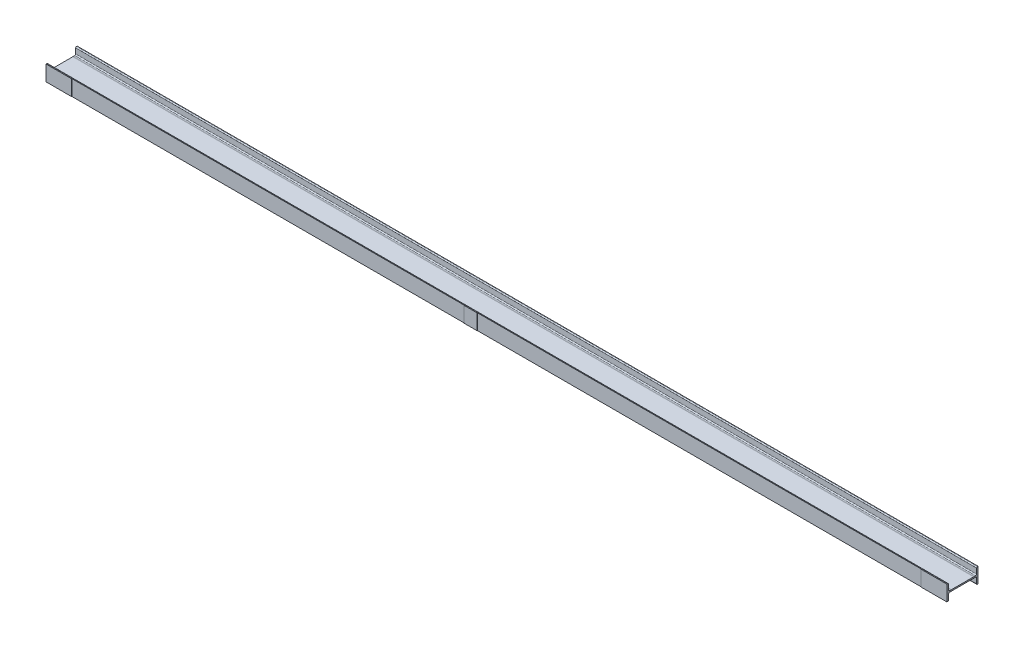
from build123d import *

# Parameters (mm, degrees)
VIGA_SB_120_X_12_2_DEPTH   = 3500
CORTAR_EXTRUIR1_DEPTH      = 3501.642798116
CORTAR_EXTRUIR1_DEPTH_BACK = 3501.642798116
CROQUIS4_W                 = 50.341677604
CROQUIS4_H                 = 60
SALIENTE_EXTRUIR1_DEPTH    = 1
CROQUIS6_W                 = 100
CROQUIS6_H                 = 60
SALIENTE_EXTRUIR2_DEPTH    = 1
SALIENTE_EXTRUIR2_2_DEPTH  = 1


with BuildPart() as part:
    # Sketch12 → Viga sb 120 X 12(2) (new body)
    with BuildSketch(Plane.YZ):
        with BuildLine():
            Line((-30, -60), (-30, -58.080070835))
            ThreePointArc((-30, -58.080070835), (-29.052095223, -55.494589303), (-26.657642624, -54.134502919))
            Line((-26.657642624, -54.134502919), (-9.184714752, -51.222135832))
            ThreePointArc((-9.184714752, -51.222135832), (-4.395809555, -48.501963064), (-2.5, -43.331))
            Line((-2.5, -43.331), (-2.5, 43.331))
            ThreePointArc((-2.5, 43.331), (-4.395809555, 48.501963064), (-9.184714752, 51.222135832))
            Line((-9.184714752, 51.222135832), (-26.657642624, 54.134502919))
            ThreePointArc((-26.657642624, 54.134502919), (-29.052095223, 55.494589303), (-30, 58.080070835))
            Line((-30, 58.080070835), (-30, 60))
            Line((-30, 60), (30, 60))
            Line((30, 60), (30, 58.080070835))
            ThreePointArc((30, 58.080070835), (29.052095223, 55.494589303), (26.657642624, 54.134502919))
            Line((26.657642624, 54.134502919), (9.184714752, 51.222135832))
            ThreePointArc((9.184714752, 51.222135832), (4.395809555, 48.501963064), (2.5, 43.331))
            Line((2.5, 43.331), (2.5, -43.331))
            ThreePointArc((2.5, -43.331), (4.395809555, -48.501963064), (9.184714752, -51.222135832))
            Line((9.184714752, -51.222135832), (26.657642624, -54.134502919))
            ThreePointArc((26.657642624, -54.134502919), (29.052095223, -55.494589303), (30, -58.080070835))
            Line((30, -58.080070835), (30, -60))
            Line((30, -60), (-30, -60))
        make_face()
    extrude(amount=VIGA_SB_120_X_12_2_DEPTH)

    # Croquis3 → Cortar-Extruir1 (cut, two sides: drawn at the far end of the back side and taken through both)
    with BuildSketch(Plane.ZY.offset(-CORTAR_EXTRUIR1_DEPTH_BACK)):
        with BuildLine():
            Line((54.134502919, 26.657642624), (44.900203823, 26.657642624))
            Line((44.900203823, 26.657642624), (44.900203823, 2.655409548))
            Line((44.900203823, 2.655409548), (50.134502919, 2.655409548))
            ThreePointArc((50.134502919, 2.655409548), (52.962930044, 3.826982423), (54.134502919, 6.655409548))
            Line((54.134502919, 6.655409548), (54.134502919, 26.657642624))
        make_face()
        with BuildLine():
            Line((54.134502919, -26.657642624), (43.331, -26.657642624))
            Line((43.331, -26.657642624), (43.331, -2.5))
            Line((43.331, -2.5), (50.134502919, -2.5))
            ThreePointArc((50.134502919, -2.5), (52.962930044, -3.671572875), (54.134502919, -6.5))
            Line((54.134502919, -6.5), (54.134502919, -26.657642624))
        make_face()
        with BuildLine():
            Line((-43.331, -26.657642624), (-43.331, -2.5))
            Line((-43.331, -2.5), (-50.134502919, -2.5))
            ThreePointArc((-50.134502919, -2.5), (-52.962930044, -3.671572875), (-54.134502919, -6.5))
            Line((-54.134502919, -6.5), (-54.134502919, -26.657642624))
            Line((-54.134502919, -26.657642624), (-43.331, -26.657642624))
        make_face()
        with BuildLine():
            Line((-44.900203823, 26.657642624), (-44.900203823, 2.655409548))
            Line((-44.900203823, 2.655409548), (-50.134502919, 2.655409548))
            ThreePointArc((-50.134502919, 2.655409548), (-52.962930044, 3.826982423), (-54.134502919, 6.655409548))
            Line((-54.134502919, 6.655409548), (-54.134502919, 26.657642624))
            Line((-54.134502919, 26.657642624), (-44.900203823, 26.657642624))
        make_face()
    extrude(amount=CORTAR_EXTRUIR1_DEPTH + CORTAR_EXTRUIR1_DEPTH_BACK, mode=Mode.SUBTRACT)


with BuildPart() as body_2:
    # Croquis4 → Saliente-Extruir1 (new body)
    with BuildSketch(Plane.XY.offset(60)):
        with Locations((1650, 0)):
            Rectangle(CROQUIS4_W, CROQUIS4_H)
    extrude(amount=SALIENTE_EXTRUIR1_DEPTH)


with BuildPart() as body_3:
    # Croquis6 → Saliente-Extruir2 (new body)
    with BuildSketch(Plane.XY.offset(60)):
        with Locations((3450, 0)):
            Rectangle(CROQUIS6_W, CROQUIS6_H)
    extrude(amount=SALIENTE_EXTRUIR2_DEPTH)


with BuildPart() as body_4:
    # Croquis6 → Saliente-Extruir2 2 (new body)
    with BuildSketch(Plane.XY.offset(60)):
        with Locations((50, 0)):
            Rectangle(CROQUIS6_W, CROQUIS6_H)
    extrude(amount=SALIENTE_EXTRUIR2_2_DEPTH)


solid = Compound([part.part, body_2.part, body_3.part, body_4.part])
